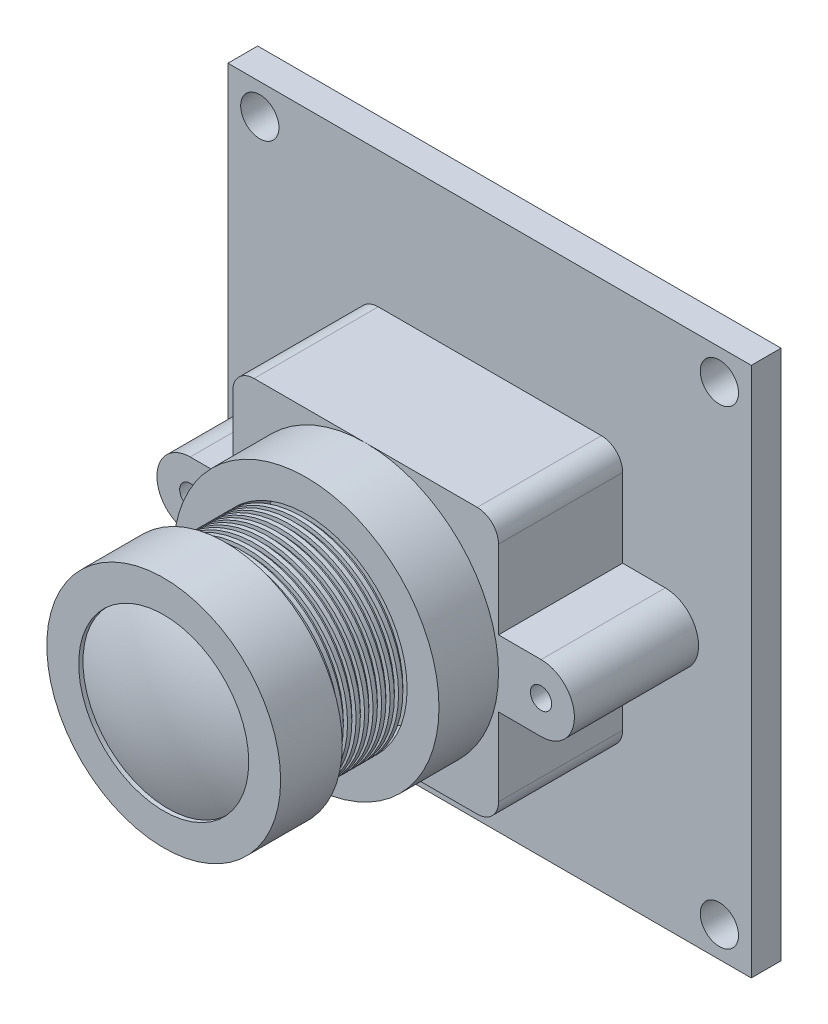
from build123d import *

# Parameters (mm, degrees)
SKETCH1_W           = 31.2674
SKETCH1_H           = 31.6992
SKETCH1_R           = 1.143
BOSS_EXTRUDE1_DEPTH = 1.778
SKETCH2_R           = 0.635
BOSS_EXTRUDE2_DEPTH = 7.4168
SKETCH3_R           = 7.9375
SKETCH3_R_2         = 6.0325
BOSS_EXTRUDE3_DEPTH = 3.556
SKETCH4_R           = 6.0325
BOSS_EXTRUDE4_DEPTH = 4.826
SKETCH5_R           = 6.985
SKETCH5_R_2         = 5.08
BOSS_EXTRUDE5_DEPTH = 3.683
SKETCH7_R           = 5.08
BOSS_EXTRUDE7_DEPTH = 3.429
DOME1_FACE_RADIUS   = 5.08
DOME1_HEIGHT        = 1.016
SKETCH8_R           = 6.0325
SKETCH8_R_2         = 5.7785
CUT_EXTRUDE1_DEPTH  = 0.254
LPATTERN1_COUNT     = 10
LPATTERN1_PITCH     = 0.508


with BuildPart() as part:
    # Sketch1 → Boss-Extrude1 (new body)
    with BuildSketch(Plane.XY):
        with Locations((-0.0127, 0.2032)):
            Rectangle(SKETCH1_W, SKETCH1_H)
        with Locations((13.716, 14.2367)):
            Circle(SKETCH1_R, mode=Mode.SUBTRACT)
        with Locations((-13.7414, 14.2367)):
            Circle(SKETCH1_R, mode=Mode.SUBTRACT)
        with Locations((13.716, -13.8303)):
            Circle(SKETCH1_R, mode=Mode.SUBTRACT)
        with Locations((-13.7414, -13.8303)):
            Circle(SKETCH1_R, mode=Mode.SUBTRACT)
    extrude(amount=BOSS_EXTRUDE1_DEPTH)

    # Sketch2 → Boss-Extrude2 (add)
    with BuildSketch(Plane.XY.offset(1.778)):
        with BuildLine():
            Line((-7.9375, 1.974663378), (-7.9375, 6.6675))
            ThreePointArc((-7.9375, 6.6675), (-7.565525612, 7.565525612), (-6.6675, 7.9375))
            Line((-6.6675, 7.9375), (6.6675, 7.9375))
            ThreePointArc((6.6675, 7.9375), (7.565525612, 7.565525612), (7.9375, 6.6675))
            Line((7.9375, 6.6675), (7.9375, 1.974663378))
            Line((7.9375, 1.974663378), (10.482302909, 1.968494141))
            ThreePointArc((10.482302909, 1.968494141), (12.471363353, -0.030233697), (10.472635515, -2.019294141))
            Line((10.472635515, -2.019294141), (7.9375, -2.01314834))
            Line((7.9375, -2.01314834), (7.9375, -6.6675))
            ThreePointArc((7.9375, -6.6675), (7.565525612, -7.565525612), (6.6675, -7.9375))
            Line((6.6675, -7.9375), (-6.6675, -7.9375))
            ThreePointArc((-6.6675, -7.9375), (-7.565525612, -7.565525612), (-7.9375, -6.6675))
            Line((-7.9375, -6.6675), (-7.9375, -2.01314834))
            Line((-7.9375, -2.01314834), (-10.472635515, -2.019294141))
            ThreePointArc((-10.472635515, -2.019294141), (-12.471363353, -0.030233697), (-10.482302909, 1.968494141))
            Line((-10.482302909, 1.968494141), (-7.9375, 1.974663378))
        make_face()
        with Locations((-10.477469212, -0.0254)):
            Circle(SKETCH2_R, mode=Mode.SUBTRACT)
        with Locations(Location((10.477469212, -0.0254, 0), (0, 0, 180))):
            Circle(SKETCH2_R, mode=Mode.SUBTRACT)
    extrude(amount=BOSS_EXTRUDE2_DEPTH)

    # Sketch3 → Boss-Extrude3 (add)
    with BuildSketch(Plane.XY.offset(9.1948)):
        with Locations(Location((0, 0, 0), (0, 0, 270))):
            Circle(SKETCH3_R)
        Circle(SKETCH3_R_2, mode=Mode.SUBTRACT)
    extrude(amount=BOSS_EXTRUDE3_DEPTH)


with BuildPart() as body_2:
    # Sketch4 → Boss-Extrude4 (new body)
    with BuildSketch(Plane.XY.offset(12.7508)):
        Circle(SKETCH4_R)
    extrude(amount=BOSS_EXTRUDE4_DEPTH)

    # Sketch5 → Boss-Extrude5 (add)
    with BuildSketch(Plane.XY.offset(17.5768)):
        Circle(SKETCH5_R)
        Circle(SKETCH5_R_2, mode=Mode.SUBTRACT)
    extrude(amount=BOSS_EXTRUDE5_DEPTH)

    # Sketch7 → Boss-Extrude7 (add)
    with BuildSketch(Plane.XY.offset(17.5768)):
        Circle(SKETCH7_R)
    extrude(amount=BOSS_EXTRUDE7_DEPTH)

    # Dome1: a dome of height H over a round flat face of radius A is a cap of a sphere of radius (A * A + H * H) / (2 * H)
    dome1_r = (DOME1_FACE_RADIUS * DOME1_FACE_RADIUS + DOME1_HEIGHT * DOME1_HEIGHT) / (2 * DOME1_HEIGHT)
    dome1_base = Plane((0, 0, 21.0058), z_dir=(0, 0, 1))
    with Locations(dome1_base.offset(DOME1_HEIGHT - dome1_r)):
        dome1_ball = Sphere(dome1_r, mode=Mode.PRIVATE)
    add(split(dome1_ball, bisect_by=dome1_base, keep=Keep.TOP, mode=Mode.PRIVATE))

    # Sketch8 → Cut-Extrude1 (cut)
    with BuildSketch(Plane.XY.offset(12.7508)):
        Circle(SKETCH8_R)
        Circle(SKETCH8_R_2, mode=Mode.SUBTRACT)
    cut_extrude1 = extrude(amount=CUT_EXTRUDE1_DEPTH, mode=Mode.SUBTRACT)

    # LPattern1: Cut-Extrude1 ×10
    with Locations(*[(0, 0, i * LPATTERN1_PITCH) for i in range(1, LPATTERN1_COUNT)]):
        add(cut_extrude1, mode=Mode.SUBTRACT)


solid = Compound([part.part, body_2.part])
